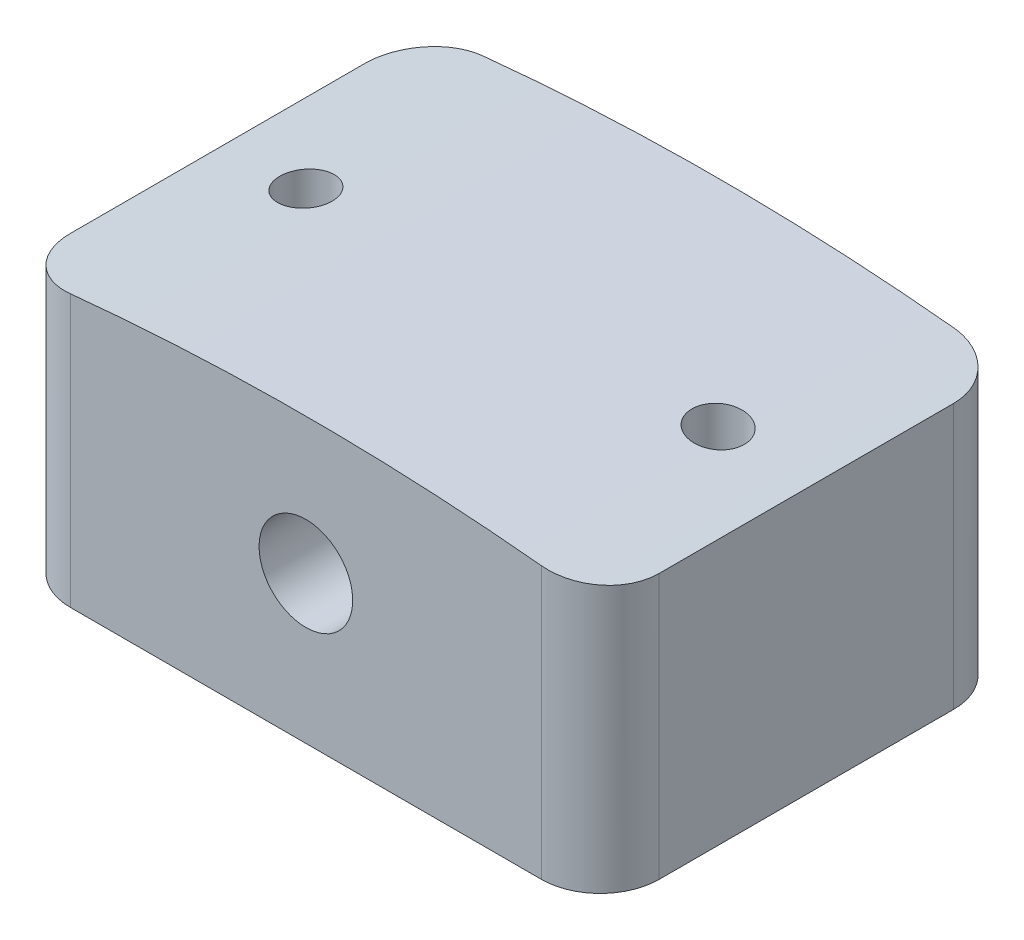
from build123d import *

# Parameters (mm, degrees)
BOSS_EXTRUDE1_DEPTH             = 8.89
BOSS_EXTRUDE1_DEPTH_BACK        = 8.89
F_1_4_0_25_DIAMETER_SLOT1_D     = 6.35
F_1_4_0_25_DIAMETER_SLOT1_DEPTH = 9.652
F_1_4_0_25_DIAMETER_SLOT1_TIP   = 1.907732465
TAP_DRILL_FOR_4_40_TAP2_D       = 2.2606
FILLET1_R                       = 2.54
F_10_32_TAPPED_HOLE1_D          = 4.0386


with BuildPart() as part:
    # Sketch1 → Boss-Extrude1 (new, two sides: drawn at the far end of the back side and taken through both)
    with BuildSketch(Plane.XY.offset(-BOSS_EXTRUDE1_DEPTH_BACK)):
        with BuildLine():
            Line((12.698670317, 100.803292467), (12.698670317, 89.373292467))
            Line((12.698670317, 89.373292467), (-12.698670317, 89.373292467))
            Line((-12.698670317, 89.373292467), (-12.698670317, 100.803292467))
            ThreePointArc((-12.698670317, 100.803292467), (0, 101.6), (12.698670317, 100.803292467))
        make_face()
    extrude(amount=BOSS_EXTRUDE1_DEPTH + BOSS_EXTRUDE1_DEPTH_BACK)

    # 1/4 (0.25) Diameter Slot1
    with Locations(Plane(origin=(0, 89.373292467, 0), x_dir=(-1, 0, 0), z_dir=(0, -1, 0))):
        with Locations((0, 0)):
            Hole(F_1_4_0_25_DIAMETER_SLOT1_D / 2, depth=F_1_4_0_25_DIAMETER_SLOT1_DEPTH)
            with Locations((0, 0, -(F_1_4_0_25_DIAMETER_SLOT1_DEPTH + F_1_4_0_25_DIAMETER_SLOT1_TIP / 2))):  # 118° drill point
                Cone(0, F_1_4_0_25_DIAMETER_SLOT1_D / 2, F_1_4_0_25_DIAMETER_SLOT1_TIP, mode=Mode.SUBTRACT)

    # Tap Drill for #4-40 Tap2 (through all)
    with Locations(Plane(origin=(0, 89.373292467, 0), x_dir=(-1, 0, 0), z_dir=(0, -1, 0))):
        with Locations((8.888670317, 0), (-8.888670317, 0)):
            Hole(TAP_DRILL_FOR_4_40_TAP2_D / 2)

    # Fillet1
    fillet1_edges = [part.edges().sort_by_distance(p)[0] for p in [
        (12.698670317, 95.088292467, -8.89),
        (-12.698670317, 95.088292467, 8.89),
        (12.698670317, 95.088292467, 8.89),
        (-12.698670317, 95.088292467, -8.89),
    ]]
    fillet(fillet1_edges, radius=FILLET1_R)

    # #10-32 Tapped Hole1 (through all)
    with Locations(Plane(origin=(0, 0, -8.89), x_dir=(-1, 0, 0), z_dir=(0, 0, -1))):
        with Locations((0, 95.723292467)):
            Hole(F_10_32_TAPPED_HOLE1_D / 2)


solid = part.part
